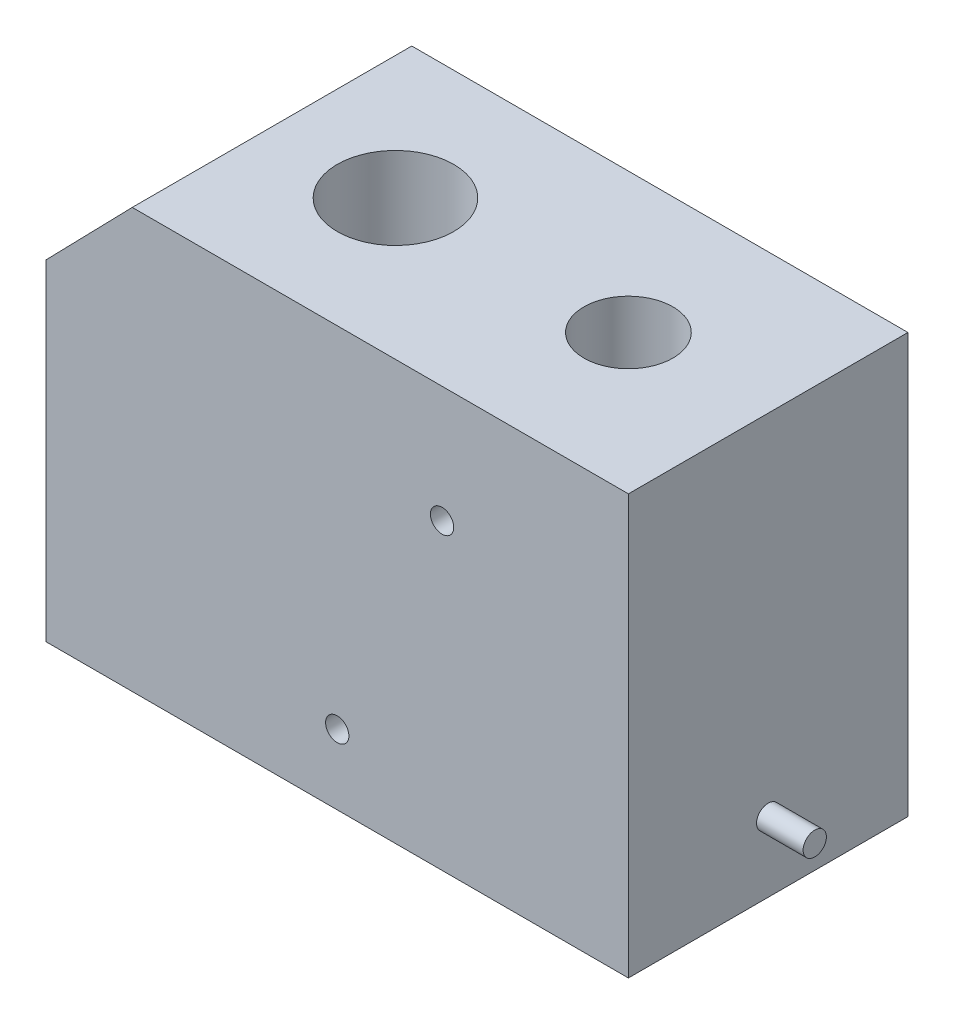
from build123d import *

# Parameters (mm, degrees)
SKETCH1_W                  = 250
SKETCH1_H                  = 180
BOSS_EXTRUDE1_DEPTH        = 120
CUT_EXTRUDE2_DEPTH         = 196.256241898
CUT_EXTRUDE2_DEPTH_BACK    = 120
SKETCH3_R                  = 5
CUT_EXTRUDE3_DEPTH         = 20
SKETCH4_R                  = 5
CUT_EXTRUDE4_DEPTH         = 20
SKETCH6_R                  = 5
CUT_EXTRUDE6_DEPTH         = 20
SKETCH7_R                  = 25
CUT_EXTRUDE7_DEPTH         = 250.849954973
SKETCH5_R                  = 5
BOSS_EXTRUDE2_DEPTH        = 20
F_10_0MM_DOWEL_HOLE1_D     = 10
F_10_0MM_DOWEL_HOLE1_DEPTH = 20
F_10_0MM_DOWEL_HOLE1_TIP   = 3.004303095
SKETCH9_R                  = 19.094825028
CUT_EXTRUDE8_DEPTH         = 50


with BuildPart() as part:
    # Sketch1 → Boss-Extrude1 (new body)
    with BuildSketch(Plane.XY):
        Rectangle(SKETCH1_W, SKETCH1_H)
    extrude(amount=BOSS_EXTRUDE1_DEPTH)

    # Sketch2 → Cut-Extrude2 (cut, two sides: drawn at the far end of the back side and taken through both)
    with BuildSketch(Plane.XY.offset(120).offset(-CUT_EXTRUDE2_DEPTH_BACK)):
        Polygon((320.124564524, 509.15495816), (-88, 90), (-125, 52), (-533.124564524, -367.15495816), (-1371.434480844, 449.094170888), (-518.185351796, 1325.404087208), align=None)
    extrude(amount=CUT_EXTRUDE2_DEPTH + CUT_EXTRUDE2_DEPTH_BACK, mode=Mode.SUBTRACT)

    # Sketch3 → Cut-Extrude3 (cut)
    with BuildSketch(Plane.XY.offset(120)):
        with Locations((45, 40)):
            Circle(SKETCH3_R)
    extrude(amount=-CUT_EXTRUDE3_DEPTH, mode=Mode.SUBTRACT)

    # Sketch4 → Cut-Extrude4 (cut)
    with BuildSketch(Plane.XY.offset(120)):
        with Locations((0, -60)):
            Circle(SKETCH4_R)
    extrude(amount=-CUT_EXTRUDE4_DEPTH, mode=Mode.SUBTRACT)

    # Sketch6 → Cut-Extrude6 (cut)
    with BuildSketch(Plane(origin=(0, 0, 0), x_dir=(-1, 0, 0), z_dir=(0, 0, -1))):
        with Locations((-55, -58)):
            Circle(SKETCH6_R)
    extrude(amount=-CUT_EXTRUDE6_DEPTH, mode=Mode.SUBTRACT)

    # Sketch7 → Cut-Extrude7 (cut, through all)
    with BuildSketch(Plane.XZ.offset(90)):
        with Locations(Location((-35, 60, 0), (0, 0, 270))):
            Circle(SKETCH7_R)
    extrude(amount=-CUT_EXTRUDE7_DEPTH, mode=Mode.SUBTRACT)

    # Sketch5 → Boss-Extrude2 (add)
    with BuildSketch(Plane(origin=(125, 0, 0), x_dir=(0, 0, -1), z_dir=(1, 0, 0))):
        with Locations(Location((-60, -60, 0), (0, 0, 180))):
            Circle(SKETCH5_R)
    extrude(amount=BOSS_EXTRUDE2_DEPTH)

    # Ø10.0mm Dowel Hole1
    with Locations(Plane(origin=(-125, -43, 98), x_dir=(0, 0, -1), z_dir=(-1, 0, 0))):
        with Locations((0, 0)):
            Hole(F_10_0MM_DOWEL_HOLE1_D / 2, depth=F_10_0MM_DOWEL_HOLE1_DEPTH)
            with Locations((0, 0, -(F_10_0MM_DOWEL_HOLE1_DEPTH + F_10_0MM_DOWEL_HOLE1_TIP / 2))):  # 118° drill point
                Cone(0, F_10_0MM_DOWEL_HOLE1_D / 2, F_10_0MM_DOWEL_HOLE1_TIP, mode=Mode.SUBTRACT)

    # Sketch9 → Cut-Extrude8 (cut)
    with BuildSketch(Plane(origin=(0, 90, 0), x_dir=(1, 0, 0), z_dir=(0, 1, 0))):
        with Locations(Location((65, -60, 0), (0, 0, 270))):
            Circle(SKETCH9_R)
    extrude(amount=-CUT_EXTRUDE8_DEPTH, mode=Mode.SUBTRACT)


solid = part.part
